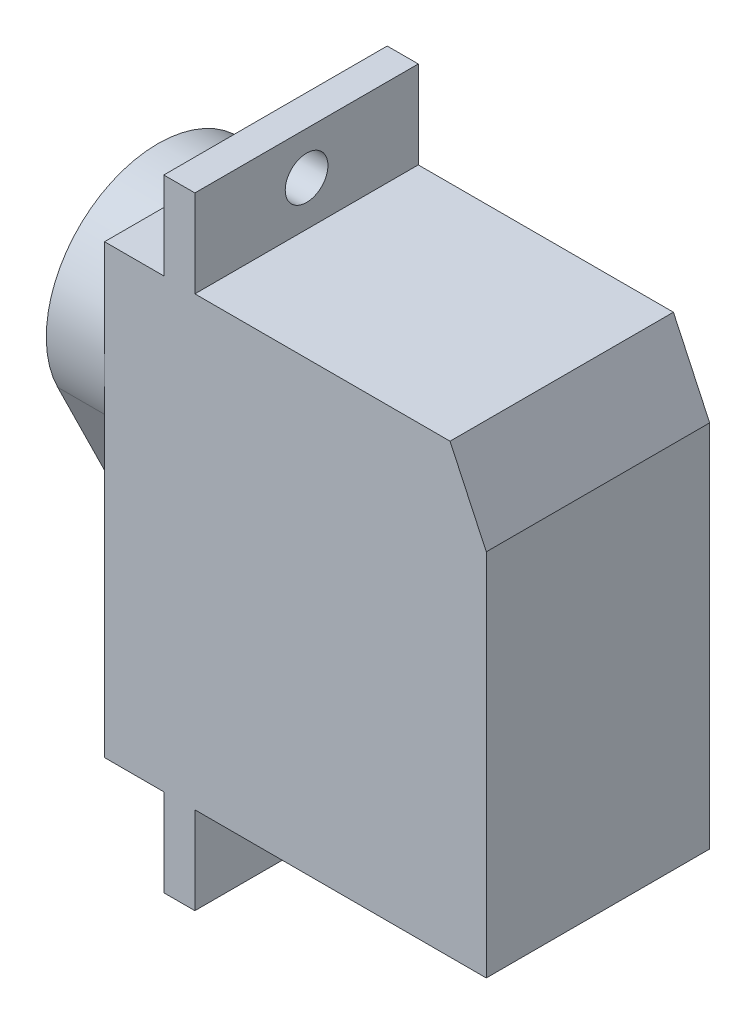
from build123d import *

# Parameters (mm, degrees)
EXTRUDE_1_DEPTH     = 11.5
SKETCH_3_R          = 1.1
CUT_EXTRUDE_1_DEPTH = 35.118323523
SKETCH_6_R          = 1.1
CUT_EXTRUDE_2_DEPTH = 35.118323523
EXTRUDE_2_DEPTH     = 3
SKETCH_8_R          = 1.1
EXTRUDE_3_DEPTH     = 3.6
SKETCH_11_R         = 2
EXTRUDE_4_DEPTH     = 2
CHAMFER_1_SIZE      = 4
CHAMFER_1_SIZE2     = 1.865230633


with BuildPart() as part:
    # 草图1 → 凸台-拉伸1 (new body)
    with BuildSketch(Plane.XY):
        Polygon((4.65, 23), (4.65, 27.5), (3.05, 27.5), (3.05, 23), (0, 23), (0, 0), (3.05, 0), (3.05, -4.5), (4.65, -4.5), (4.65, 0), (19.65, 0), (19.65, 23), align=None)
    extrude(amount=EXTRUDE_1_DEPTH)

    # 草图3 → 切除-拉伸1 (cut, through all)
    with BuildSketch(Plane.ZY.offset(-3.05)):
        with Locations((5.75, 25.3)):
            Circle(SKETCH_3_R)
    extrude(amount=-CUT_EXTRUDE_1_DEPTH, mode=Mode.SUBTRACT)

    # 草图6 → 切除-拉伸2 (cut, through all)
    with BuildSketch(Plane.ZY.offset(-3.05)):
        with Locations((5.75, -2.3)):
            Circle(SKETCH_6_R)
    extrude(amount=-CUT_EXTRUDE_2_DEPTH, mode=Mode.SUBTRACT)

    # 草图10 → 凸台-拉伸2 (add)
    with BuildSketch(Plane.ZY):
        with BuildLine():
            Line((0.589316609, 14.714285714), (3.775477659, 8.229813665))
            ThreePointArc((3.775477659, 8.229813665), (5.75, 7), (7.724522341, 8.229813665))
            Line((7.724522341, 8.229813665), (10.910683391, 14.714285714))
            ThreePointArc((10.910683391, 14.714285714), (5.75, 23), (0.589316609, 14.714285714))
        make_face()
    extrude(amount=EXTRUDE_2_DEPTH)

    # 草图8 → 凸台-拉伸3 (add)
    with BuildSketch(Plane.ZY):
        with Locations((5.75, 9.2)):
            Circle(SKETCH_8_R)
    extrude(amount=EXTRUDE_3_DEPTH)

    # 草图11 → 凸台-拉伸4 (add)
    with BuildSketch(Plane.ZY.offset(3)):
        with Locations((5.75, 17.25)):
            Circle(SKETCH_11_R)
    extrude(amount=EXTRUDE_4_DEPTH)

    # 倒角1
    chamfer_1_edges = [part.edges().sort_by_distance(p)[0] for p in [
        (19.65, 23, 5.75),
    ]]
    chamfer_1_side = [part.faces().sort_by_distance(p)[0] for p in [
        (19.65, 11.5, 5.75),
    ]]
    chamfer(chamfer_1_edges, length=CHAMFER_1_SIZE, length2=CHAMFER_1_SIZE2, reference=chamfer_1_side[0])


solid = part.part
